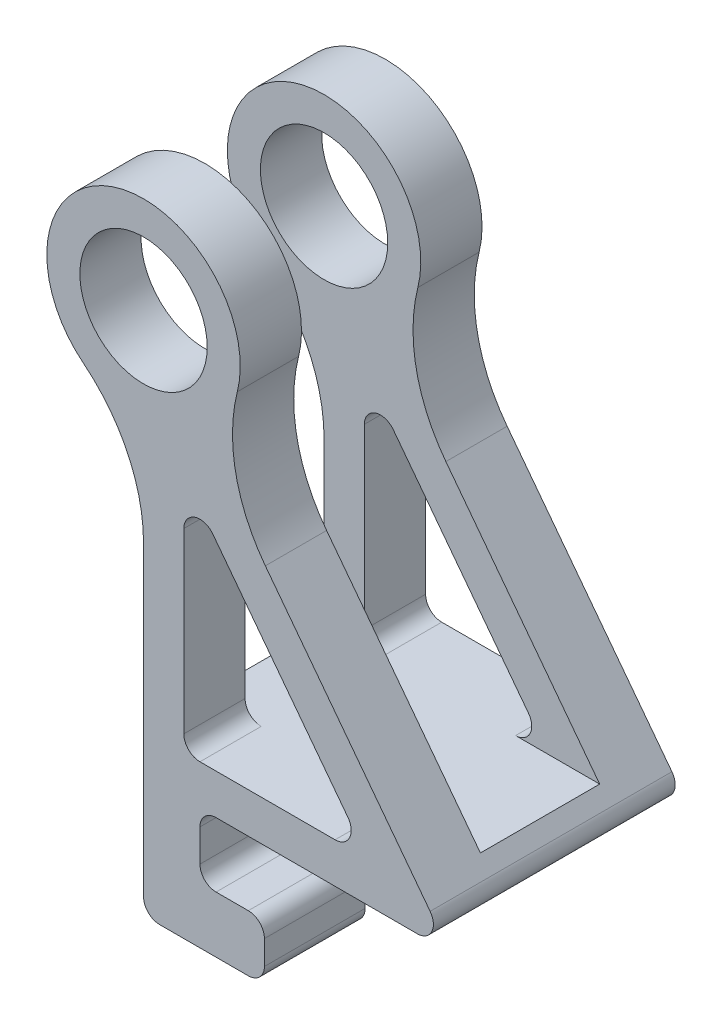
from build123d import *

# Parameters (mm, degrees)
BOSS_EXTRUDE1_DEPTH = 38.1
SKETCH2_R           = 15.24
BOSS_EXTRUDE2_DEPTH = 38.1
SKETCH3_R           = 10.033
SKETCH3_W           = 10.16
SKETCH3_H           = 10.16
CUT_EXTRUDE1_DEPTH  = 109.091847981
FILLET9_R           = 25.4
FILLET14_R          = 2.54
FILLET15_R          = 2.54
FILLET16_R          = 2.54
FILLET17_R          = 2.54
CUT_EXTRUDE2_REACH  = 124.665
SKETCH4_W           = 10.16
SKETCH4_H           = 6.35
SKETCH6_W           = 76.2
SKETCH6_H           = 18.796
CUT_EXTRUDE3_DEPTH  = 104.55757867


with BuildPart() as part:
    # Sketch1 → Boss-Extrude1 (new body)
    with BuildSketch(Plane(origin=(0, 0, 0), x_dir=(0, 1, 0), z_dir=(0, 0, 1))):
        Polygon((0, 48.26), (63.5, 48.26), (0, 0), (0, 29.21), (-19.05, 29.21), (-19.05, 48.26), align=None)
    extrude(amount=BOSS_EXTRUDE1_DEPTH)

    # Sketch2 → Boss-Extrude2 (add)
    with BuildSketch(Plane(origin=(0, 0, 38.1), x_dir=(0, -1, 0), z_dir=(0, 0, 1))):
        with Locations((-63.5, -48.26)):
            Circle(SKETCH2_R)
    extrude(amount=-BOSS_EXTRUDE2_DEPTH)

    # Sketch3 → Cut-Extrude1 (cut, through all)
    with BuildSketch(Plane.XY.offset(38.1)):
        with Locations((-48.26, 63.5)):
            Circle(SKETCH3_R)
        with Locations((-34.29, -5.08)):
            Rectangle(SKETCH3_W, SKETCH3_H)
        Polygon((-12.954, 6.35), (-41.91, 6.35), (-41.91, 44.45), align=None)
    extrude(amount=-CUT_EXTRUDE1_DEPTH, mode=Mode.SUBTRACT)

    # Fillet9
    fillet9_edges = [part.edges().sort_by_distance(p)[0] for p in [
        (-39.038531003, 51.366488162, 19.05),
        (-48.26, 48.26, 19.05),
    ]]
    fillet(fillet9_edges, radius=FILLET9_R)

    # Fillet14
    fillet14_edges = [part.edges().sort_by_distance(p)[0] for p in [
        (-41.91, 44.45, 19.05),
        (-12.954, 6.35, 19.05),
        (-41.91, 6.35, 19.05),
    ]]
    fillet(fillet14_edges, radius=FILLET14_R)

    # Fillet15
    fillet15_edges = [part.edges().sort_by_distance(p)[0] for p in [
        (-39.37, -10.16, 19.05),
        (-39.37, 0, 19.05),
    ]]
    fillet(fillet15_edges, radius=FILLET15_R)

    # Fillet16
    fillet16_edges = [part.edges().sort_by_distance(p)[0] for p in [
        (-29.21, -10.16, 19.05),
    ]]
    fillet(fillet16_edges, radius=FILLET16_R)

    # Fillet17
    fillet17_edges = [part.edges().sort_by_distance(p)[0] for p in [
        (-29.21, -19.05, 19.05),
        (-48.26, -19.05, 19.05),
        (0, 0, 19.05),
    ]]
    fillet(fillet17_edges, radius=FILLET17_R)

    # Sketch4 → Cut-Extrude2 (cut, up to next)
    with BuildSketch(Plane.XZ.offset(19.05), mode=Mode.PRIVATE) as cut_extrude2_sk1:
        with Locations((-34.29, 19.05)):
            Rectangle(SKETCH4_W, SKETCH4_H)
    cut_extrude2_tool1 = extrude(cut_extrude2_sk1.sketch, amount=-CUT_EXTRUDE2_REACH, mode=Mode.PRIVATE) & part.part
    add(cut_extrude2_tool1.solids().sort_by_distance((-34.29, -19.05, 19.05))[0], mode=Mode.SUBTRACT)

    # Sketch6 → Cut-Extrude3 (cut, through all)
    with BuildSketch(Plane(origin=(0, 6.35, 0), x_dir=(-1, 0, 0), z_dir=(0, 1, 0))):
        with Locations((27.795452673, 19.05)):
            Rectangle(SKETCH6_W, SKETCH6_H)
    extrude(amount=CUT_EXTRUDE3_DEPTH, mode=Mode.SUBTRACT)


solid = part.part
